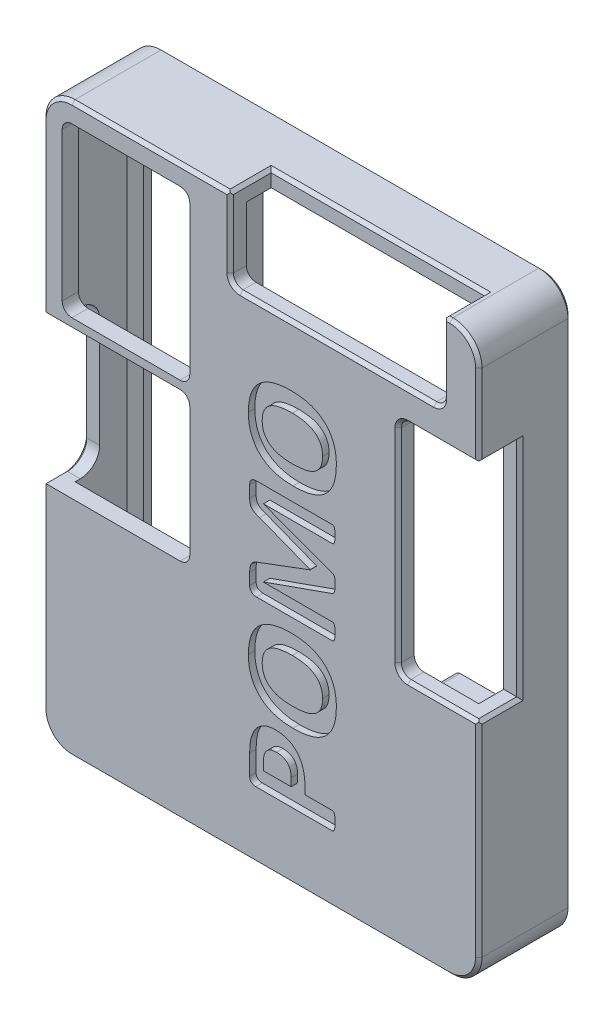
from build123d import *

# Parameters (mm, degrees)
SKETCH_1_W          = 27
SKETCH_1_H          = 35.2
SKETCH_1_W_2        = 25
SKETCH_1_H_2        = 33.2
EXTRUDE_1_DEPTH     = 2
SKETCH_1_3_W        = 27
SKETCH_1_3_H        = 35.2
SKETCH_1_3_W_2      = 25
SKETCH_1_3_H_2      = 33.2
EXTRUDE_2_DEPTH     = 3.72
FILLET_1_R          = 1.8
FILLET_2_R          = 0.8
CUT_EXTRUDE_1_REACH = 34.444
SKETCH_2_W          = 5.04
SKETCH_2_H          = 9.2
FILLET_3_R          = 1.2
CHAMFER_1_SIZE      = 0.2
EXTRUDE_START       = -1
EXTRUDE_3_DEPTH     = 1
SKETCH_4_W          = 1
SKETCH_4_H          = 9.2
CUT_EXTRUDE_2_DEPTH = 8.1
FILLET_4_R          = 0.6
CUT_EXTRUDE_3_DEPTH = 2.54
FILLET_5_R          = 0.6
SKETCH_6_W          = 2
SKETCH_6_H          = 3
EXTRUDE_4_DEPTH     = 1.54
FILLET_6_R          = 0.3
SKETCH_7_W          = 13.2
SKETCH_7_H          = 5
CUT_EXTRUDE_4_DEPTH = 2.54
FILLET_7_R          = 0.6
CHAMFER_2_SIZE      = 0.2
SKETCH_8_W          = 5
SKETCH_8_H          = 13.8
CUT_EXTRUDE_5_DEPTH = 2.54
FILLET_8_R          = 0.6
SKETCH_9_W          = 3
SKETCH_9_H          = 1.5
EXTRUDE_5_DEPTH     = 1.54
FILLET_9_R          = 0.3
SKETCH_10_W         = 1.5
SKETCH_10_H         = 8
EXTRUDE_6_DEPTH     = 1.54
FILLET_10_R         = 0.3
SKETCH_11_W         = 2.5
SKETCH_11_H         = 2.5
EXTRUDE_7_DEPTH     = 1.54
FILLET_11_R         = 0.3
CHAMFER_3_SIZE      = 0.2
CHAMFER_4_SIZE      = 0.2
CHAMFER_5_SIZE      = 0.2
CUT_EXTRUDE_6_DEPTH = 0.4
CHAMFER_6_SIZE      = 0.2


with BuildPart() as part:
    # 草图1 → 凸台-拉伸1 (new body)
    with BuildSketch(Plane.XY):
        Rectangle(SKETCH_1_W, SKETCH_1_H)
        Rectangle(SKETCH_1_W_2, SKETCH_1_H_2, mode=Mode.SUBTRACT)
    extrude(amount=-EXTRUDE_1_DEPTH)

    # 草图1<3> → 凸台-拉伸2 (add)
    with BuildSketch(Plane.XY):
        Rectangle(SKETCH_1_3_W, SKETCH_1_3_H)
        Rectangle(SKETCH_1_3_W_2, SKETCH_1_3_H_2, mode=Mode.SUBTRACT)
    extrude(amount=EXTRUDE_2_DEPTH)

    # 圆角1
    fillet_1_edges = [part.edges().sort_by_distance(p)[0] for p in [
        (-13.5, 17.6, 0.86),
        (13.5, 17.6, 0.86),
        (13.5, -17.6, 0.86),
        (-13.5, -17.6, 0.86),
    ]]
    fillet(fillet_1_edges, radius=FILLET_1_R)

    # 圆角2
    fillet_2_edges = [part.edges().sort_by_distance(p)[0] for p in [
        (-12.5, 16.6, 0.86),
        (12.5, 16.6, 0.86),
        (12.5, -16.6, 0.86),
        (-12.5, -16.6, 0.86),
    ]]
    fillet(fillet_2_edges, radius=FILLET_2_R)

    # 草图2 → 切除-拉伸1 (cut, up to next)
    with BuildSketch(Plane.ZY.offset(13.5), mode=Mode.PRIVATE) as cut_extrude_1_sk1:
        with Locations((3.72, 0.9)):
            Rectangle(SKETCH_2_W, SKETCH_2_H)
    cut_extrude_1_tool1 = extrude(cut_extrude_1_sk1.sketch, amount=-CUT_EXTRUDE_1_REACH, mode=Mode.PRIVATE) & part.part
    add(cut_extrude_1_tool1.solids().sort_by_distance((-13.5, 0.9, 3.72))[0], mode=Mode.SUBTRACT)

    # 圆角3
    fillet_3_edges = [part.edges().sort_by_distance(p)[0] for p in [
        (-13, 5.5, 1.2),
        (-13, -3.7, 1.2),
    ]]
    fillet(fillet_3_edges, radius=FILLET_3_R)

    # 倒角1
    chamfer_1_edges = [part.edges().sort_by_distance(p)[0] for p in [
        (-13.5, 5.5, 3.06),
        (-13.5, -3.7, 3.06),
        (-13.5, 0.9, 1.2),
        (-13.5, -3.348528137, 1.551471863),
        (-13.5, 5.148528137, 1.551471863),
    ]]
    chamfer(chamfer_1_edges, length=CHAMFER_1_SIZE)

    # 草图3 → 凸台-拉伸3 (add)
    with BuildSketch(Plane.XY.offset(3.72).offset(EXTRUDE_START)):
        with BuildLine():
            Line((-12.5, 5.5), (-12.5, -3.7))
            Line((-12.5, -3.7), (-12.5, -15.8))
            ThreePointArc((-12.5, -15.8), (-12.265685425, -16.365685425), (-11.7, -16.6))
            Line((-11.7, -16.6), (11.7, -16.6))
            ThreePointArc((11.7, -16.6), (12.265685425, -16.365685425), (12.5, -15.8))
            Line((12.5, -15.8), (12.5, 15.8))
            ThreePointArc((12.5, 15.8), (12.265685425, 16.365685425), (11.7, 16.6))
            Line((11.7, 16.6), (-11.7, 16.6))
            ThreePointArc((-11.7, 16.6), (-12.265685425, 16.365685425), (-12.5, 15.8))
            Line((-12.5, 15.8), (-12.5, 5.5))
        make_face()
    extrude(amount=EXTRUDE_3_DEPTH)

    # 草图4 → 切除-拉伸2 (cut)
    with BuildSketch(Plane.ZY.offset(12.5)):
        with Locations((3.22, 0.9)):
            Rectangle(SKETCH_4_W, SKETCH_4_H)
    extrude(amount=-CUT_EXTRUDE_2_DEPTH, mode=Mode.SUBTRACT)

    # 圆角4
    fillet_4_edges = [part.edges().sort_by_distance(p)[0] for p in [
        (-4.4, 5.5, 3.22),
        (-4.4, -3.7, 3.22),
    ]]
    fillet(fillet_4_edges, radius=FILLET_4_R)

    # 草图5 → 切除-拉伸3 (cut)
    with BuildSketch(Plane.XY.offset(3.72)):
        with BuildLine():
            Line((-12.3, 6), (-4.4, 6))
            Line((-4.4, 6), (-4.4, 16.4))
            Line((-4.4, 16.4), (-5.6, 16.4))
            Line((-5.6, 16.4), (-11.7, 16.4))
            ThreePointArc((-11.7, 16.4), (-12.124264069, 16.224264069), (-12.3, 15.8))
            Line((-12.3, 15.8), (-12.3, 7.2))
            Line((-12.3, 7.2), (-12.3, 6))
        make_face()
    extrude(amount=-CUT_EXTRUDE_3_DEPTH, mode=Mode.SUBTRACT)

    # 圆角5
    fillet_5_edges = [part.edges().sort_by_distance(p)[0] for p in [
        (-4.4, 16.4, 3.22),
        (-4.4, 6, 3.22),
        (-12.3, 6, 3.22),
    ]]
    fillet(fillet_5_edges, radius=FILLET_5_R)

    # 草图6 → 凸台-拉伸4 (add)
    with BuildSketch(Plane(origin=(0, 0, 2.72), x_dir=(-1, 0, 0), z_dir=(0, 0, -1))):
        with Locations((4.3, -15.1)):
            Rectangle(SKETCH_6_W, SKETCH_6_H)
    extrude(amount=EXTRUDE_4_DEPTH)

    # 圆角6
    fillet_6_edges = [part.edges().sort_by_distance(p)[0] for p in [
        (-5.3, -16.6, 1.95),
        (-5.3, -13.6, 1.95),
        (-3.3, -13.6, 1.95),
        (-3.3, -16.6, 1.95),
    ]]
    fillet(fillet_6_edges, radius=FILLET_6_R)

    # 草图7 → 切除-拉伸4 (cut)
    with BuildSketch(Plane.XY.offset(3.72)):
        with Locations((4.7, 15.1)):
            Rectangle(SKETCH_7_W, SKETCH_7_H)
    extrude(amount=-CUT_EXTRUDE_4_DEPTH, mode=Mode.SUBTRACT)

    # 圆角7
    fillet_7_edges = [part.edges().sort_by_distance(p)[0] for p in [
        (11.3, 12.6, 3.22),
        (-1.9, 12.6, 3.22),
    ]]
    fillet(fillet_7_edges, radius=FILLET_7_R)

    # 倒角2
    chamfer_2_edges = [part.edges().sort_by_distance(p)[0] for p in [
        (11.3, 17.6, 2.45),
        (4.7, 17.6, 1.18),
        (-1.9, 17.6, 2.45),
    ]]
    chamfer(chamfer_2_edges, length=CHAMFER_2_SIZE)

    # 草图8 → 切除-拉伸5 (cut)
    with BuildSketch(Plane.XY.offset(3.72)):
        with Locations((11, 3.8)):
            Rectangle(SKETCH_8_W, SKETCH_8_H)
    extrude(amount=-CUT_EXTRUDE_5_DEPTH, mode=Mode.SUBTRACT)

    # 圆角8
    fillet_8_edges = [part.edges().sort_by_distance(p)[0] for p in [
        (8.5, -3.1, 3.22),
        (8.5, 10.7, 3.22),
    ]]
    fillet(fillet_8_edges, radius=FILLET_8_R)

    # 草图9 → 凸台-拉伸5 (add)
    with BuildSketch(Plane(origin=(0, 0, 2.72), x_dir=(-1, 0, 0), z_dir=(0, 0, -1))):
        with Locations((-11, -4.35)):
            Rectangle(SKETCH_9_W, SKETCH_9_H)
    extrude(amount=EXTRUDE_5_DEPTH)

    # 圆角9
    fillet_9_edges = [part.edges().sort_by_distance(p)[0] for p in [
        (12.5, -3.6, 1.95),
        (12.5, -5.1, 1.95),
        (9.5, -5.1, 1.95),
        (9.5, -3.6, 1.95),
    ]]
    fillet(fillet_9_edges, radius=FILLET_9_R)

    # 草图10 → 凸台-拉伸6 (add)
    with BuildSketch(Plane(origin=(0, 0, 2.72), x_dir=(-1, 0, 0), z_dir=(0, 0, -1))):
        with Locations((3.15, 12.6)):
            Rectangle(SKETCH_10_W, SKETCH_10_H)
    extrude(amount=EXTRUDE_6_DEPTH)

    # 圆角10
    fillet_10_edges = [part.edges().sort_by_distance(p)[0] for p in [
        (-2.4, 16.6, 1.95),
        (-2.4, 8.6, 1.95),
        (-3.9, 8.6, 1.95),
        (-3.9, 16.6, 1.95),
    ]]
    fillet(fillet_10_edges, radius=FILLET_10_R)

    # 草图11 → 凸台-拉伸7 (add)
    with BuildSketch(Plane(origin=(0, 0, 2.72), x_dir=(-1, 0, 0), z_dir=(0, 0, -1))):
        with Locations((2.75, -3.65)):
            Rectangle(SKETCH_11_W, SKETCH_11_H)
    extrude(amount=EXTRUDE_7_DEPTH)

    # 圆角11
    fillet_11_edges = [part.edges().sort_by_distance(p)[0] for p in [
        (-1.5, -2.4, 1.95),
        (-1.5, -4.9, 1.95),
        (-4, -4.9, 1.95),
        (-4, -2.4, 1.95),
    ]]
    fillet(fillet_11_edges, radius=FILLET_11_R)

    # 倒角3
    chamfer_3_edges = [part.edges().sort_by_distance(p)[0] for p in [
        (13.5, -3.1, 2.45),
        (13.5, 3.8, 1.18),
        (13.5, 10.7, 2.45),
    ]]
    chamfer(chamfer_3_edges, length=CHAMFER_3_SIZE)

    # 倒角4
    chamfer_4_edges = [part.edges().sort_by_distance(p)[0] for p in [
        (-1.9, 15.3, 3.72),
        (11.3, 15.3, 3.72),
        (-1.724264069, 12.775735931, 3.72),
        (11.124264069, 12.775735931, 3.72),
        (4.7, 12.6, 3.72),
        (11.2, 10.7, 3.72),
        (11.2, -3.1, 3.72),
        (8.675735931, 10.524264069, 3.72),
        (8.675735931, -2.924264069, 3.72),
        (8.5, 3.8, 3.72),
    ]]
    chamfer(chamfer_4_edges, length=CHAMFER_4_SIZE)

    # 倒角5
    chamfer_5_edges = [part.edges().sort_by_distance(p)[0] for p in [
        (-6.9, 17.6, 3.72),
        (-12.972792206, 17.072792206, 3.72),
        (-13.5, 10.75, 3.72),
        (-13.5, -9.85, 3.72),
        (-12.972792206, -17.072792206, 3.72),
        (0, -17.6, 3.72),
        (12.972792206, -17.072792206, 3.72),
        (13.5, -9.55, 3.72),
        (11.6, 17.6, 3.72),
        (12.972792206, 17.072792206, 3.72),
        (13.5, 13.35, 3.72),
    ]]
    chamfer(chamfer_5_edges, length=CHAMFER_5_SIZE)

    # 草图12 → 切除-拉伸6 (cut)
    # profile 1 of 4: a face of its own
    with BuildSketch(Plane.XY.offset(3.72)):
        with BuildLine():
            add(Edge.make_bspline(
                [(0.901183364, -9.797794118), (0.972613791, -9.799211183), (1.111951502, -9.801975421), (1.314597214, -9.829791984), (1.505248522, -9.872435397), (1.682328126, -9.935059128), (1.846507268, -10.013399884), (1.99853428, -10.106594555), (2.134980403, -10.2186544), (2.259084362, -10.344600654), (2.368837936, -10.486871016), (2.465469751, -10.644435066), (2.546343318, -10.818241139), (2.614830726, -11.00644666), (2.668470661, -11.210700715), (2.705151223, -11.43212498), (2.728876729, -11.670597787), (2.73116948, -11.835608879), (2.732352941, -11.920783548)],
                knots=[0, 0, 0, 0, 1.074539163, 2.09607912, 3.072771053, 4.010465737, 4.916386775, 5.806831823, 6.687188898, 7.56722886, 8.462903837, 9.385716073, 10.343574317, 11.343239745, 12.39679321, 13.517064009, 14.718369485, 16, 16, 16, 16], degree=3))
            Line((2.732352941, -11.920783548), (2.732352941, -12.365808824))
            Line((2.732352941, -12.365808824), (4.42733992, -12.365808824))
            add(Edge.make_bspline(
                [(4.42733992, -12.365808824), (4.440606458, -12.366812536), (4.467642206, -12.368857992), (4.504518981, -12.392225512), (4.536551454, -12.429600756), (4.558138956, -12.486457401), (4.575653381, -12.560407983), (4.589954729, -12.655590339), (4.599755754, -12.775370304), (4.599912902, -12.863902664), (4.6, -12.912971048)],
                knots=[0, 0, 0, 0, 0.507711762, 1.034660904, 1.634861559, 2.386155658, 3.355649824, 4.577255722, 6.102970134, 8, 8, 8, 8], degree=3))
            add(Edge.make_bspline(
                [(4.6, -12.912971048), (4.599869662, -12.960819527), (4.599630734, -13.048533035), (4.589944903, -13.167933863), (4.575669786, -13.263859393), (4.558513881, -13.338101152), (4.536077842, -13.393927231), (4.505400135, -13.431352123), (4.467884047, -13.45193083), (4.441749907, -13.454149494), (4.428555836, -13.455269608)],
                knots=[0, 0, 0, 0, 1.863820652, 3.416665485, 4.662998336, 5.639730434, 6.382161058, 6.986842619, 7.488497825, 8, 8, 8, 8], degree=3))
            Line((4.428555836, -13.455269608), (-0.30865311, -13.455269608))
            add(Edge.make_bspline(
                [(-0.30865311, -13.455269608), (-0.33878567, -13.454405815), (-0.395719766, -13.452773719), (-0.475219877, -13.432574084), (-0.543582193, -13.401685625), (-0.598746602, -13.356387224), (-0.640226496, -13.300832057), (-0.669790503, -13.237002902), (-0.688669696, -13.165327508), (-0.690639938, -13.114532932), (-0.691666667, -13.08806296)],
                knots=[0, 0, 0, 0, 1.197016791, 2.261708478, 3.243544502, 4.161063564, 5.071314752, 5.980993455, 6.947859145, 8, 8, 8, 8], degree=3))
            Line((-0.691666667, -13.08806296), (-0.691666667, -11.828373928))
            add(Edge.make_bspline(
                [(-0.691666667, -11.828373928), (-0.6907798, -11.766766495), (-0.689045787, -11.646310894), (-0.682158919, -11.495707935), (-0.668551676, -11.374282396), (-0.655335546, -11.276142007), (-0.637598328, -11.1696505), (-0.618584906, -11.055049285), (-0.589238336, -10.936068308), (-0.55193587, -10.814551783), (-0.502161505, -10.693415718), (-0.44652035, -10.571471491), (-0.380338726, -10.453642017), (-0.302974791, -10.345050714), (-0.220811748, -10.242403543), (-0.127733921, -10.151708092), (-0.027590505, -10.069407072), (0.080976572, -9.997314393), (0.198101193, -9.936531626), (0.323304562, -9.886739659), (0.456046227, -9.845932092), (0.597546392, -9.81889316), (0.746724136, -9.801269834), (0.848846104, -9.798971836), (0.901183364, -9.797794118)],
                knots=[0, 0, 0, 0, 1.386044595, 2.710011219, 3.388595705, 4.13384621, 4.937223913, 5.817091178, 6.745811508, 7.691603293, 8.673527662, 9.689156292, 10.705766521, 11.707344315, 12.685579538, 13.659044931, 14.624450845, 15.597958928, 16.584780707, 17.587022182, 18.625313044, 19.703465755, 20.82303179, 22, 22, 22, 22], degree=3))
        make_face()
        with BuildLine():
            add(Edge.make_bspline(
                [(0.979001991, -10.965073529), (0.936777326, -10.966140914), (0.855549264, -10.968194253), (0.739557935, -10.986514524), (0.634913296, -11.016290284), (0.543014646, -11.059597433), (0.463061664, -11.111045532), (0.392481067, -11.166517204), (0.334582461, -11.229861951), (0.272368161, -11.319526809), (0.216659845, -11.441553261), (0.181448357, -11.596102223), (0.167215574, -11.754304108), (0.165305604, -11.860777116), (0.164338235, -11.914703968)],
                knots=[0, 0, 0, 0, 1.056080103, 2.031593088, 2.93025641, 3.769730843, 4.563214341, 5.306142896, 6.009595314, 6.701769354, 8.031456872, 9.335322757, 10.6503842, 12, 12, 12, 12], degree=3))
            Line((0.164338235, -11.914703968), (0.164338235, -12.365808824))
            Line((0.164338235, -12.365808824), (1.876348039, -12.365808824))
            Line((1.876348039, -12.365808824), (1.876348039, -11.890385646))
            add(Edge.make_bspline(
                [(1.876348039, -11.890385646), (1.875968306, -11.849803448), (1.875240657, -11.77203935), (1.860909636, -11.660728843), (1.841123431, -11.559125362), (1.811935037, -11.467377075), (1.774667723, -11.385139637), (1.732709692, -11.310130951), (1.682008802, -11.244199202), (1.607380601, -11.165739072), (1.494883483, -11.085066716), (1.339058118, -11.016701924), (1.164529299, -10.972930489), (1.042090811, -10.9677453), (0.979001991, -10.965073529)],
                knots=[0, 0, 0, 0, 0.995035643, 1.906699277, 2.749344999, 3.532547668, 4.262672946, 4.96214497, 5.63648749, 6.29772035, 7.614676787, 8.999192117, 10.453775203, 12, 12, 12, 12], degree=3))
        make_face(mode=Mode.SUBTRACT)
    # profile 2 of 4: a face of its own
    with BuildSketch(Plane.XY.offset(3.72)):
        with BuildLine():
            add(Edge.make_bspline(
                [(1.893370864, -4.117034314), (1.999654359, -4.118560019), (2.207046323, -4.121537142), (2.508873867, -4.154579405), (2.793941042, -4.204135629), (3.060625051, -4.277632617), (3.310245256, -4.369545137), (3.540637443, -4.482582813), (3.751816608, -4.615807107), (3.942403272, -4.76962472), (4.112569194, -4.943464761), (4.261889006, -5.13666699), (4.388927285, -5.34987787), (4.493348394, -5.582206132), (4.576445481, -5.833092318), (4.635614459, -6.103178409), (4.670976803, -6.392289308), (4.675496803, -6.59132184), (4.677818627, -6.693560432)],
                knots=[0, 0, 0, 0, 1.181156535, 2.304801635, 3.371651323, 4.394860601, 5.375831947, 6.325011814, 7.242593292, 8.146204565, 9.041610307, 9.941122527, 10.854567612, 11.794352514, 12.76760377, 13.787642918, 14.863561291, 16, 16, 16, 16], degree=3))
            add(Edge.make_bspline(
                [(4.677818627, -6.693560432), (4.676200771, -6.794164316), (4.673061466, -6.98937714), (4.641758464, -7.272280387), (4.593240461, -7.535845114), (4.522619889, -7.779550451), (4.431554699, -8.00371163), (4.318756282, -8.20843718), (4.186240697, -8.394996592), (4.029911707, -8.560489399), (3.852128128, -8.706278115), (3.651875886, -8.831700332), (3.43028259, -8.939344475), (3.185488916, -9.026341289), (2.918494823, -9.094351889), (2.628261615, -9.140356928), (2.315515326, -9.170261596), (2.098934824, -9.173547036), (1.9869964, -9.175245098)],
                knots=[0, 0, 0, 0, 1.14605125, 2.223809784, 3.239278066, 4.196657126, 5.110123641, 5.990760065, 6.854667985, 7.710749604, 8.577135683, 9.46770869, 10.397275983, 11.379066547, 12.423123567, 13.532494508, 14.724683554, 16, 16, 16, 16], degree=3))
            add(Edge.make_bspline(
                [(1.9869964, -9.175245098), (1.883173295, -9.172994873), (1.680340341, -9.168598744), (1.384159298, -9.138703639), (1.104262144, -9.085710504), (0.840174866, -9.015104438), (0.593423686, -8.922957216), (0.365967927, -8.809046986), (0.15645787, -8.676508104), (-0.032933786, -8.522650254), (-0.201824539, -8.348442092), (-0.350852833, -8.155861596), (-0.478306777, -7.943131122), (-0.583990262, -7.711026251), (-0.668376965, -7.459377825), (-0.727071368, -7.188240371), (-0.762789455, -6.897978988), (-0.767207257, -6.698125529), (-0.769485294, -6.595071232)],
                knots=[0, 0, 0, 0, 1.16084357, 2.267870255, 3.323776688, 4.342865402, 5.320924859, 6.263320928, 7.182293669, 8.087520472, 8.984851861, 9.889477264, 10.804227807, 11.751232516, 12.735748365, 13.766010587, 14.848044905, 16, 16, 16, 16], degree=3))
            add(Edge.make_bspline(
                [(-0.769485294, -6.595071232), (-0.76789129, -6.496487466), (-0.764793529, -6.30490135), (-0.733030949, -6.027002269), (-0.685900875, -5.766659049), (-0.616490073, -5.524605941), (-0.526680642, -5.300307738), (-0.414838562, -5.095074424), (-0.28078951, -4.909588578), (-0.126261279, -4.742810334), (0.049759607, -4.594030569), (0.249924795, -4.468650837), (0.469327865, -4.358877902), (0.711459072, -4.270930254), (0.975267052, -4.201849097), (1.261231859, -4.152810223), (1.569657019, -4.121775428), (1.783049216, -4.118650085), (1.893370864, -4.117034314)],
                knots=[0, 0, 0, 0, 1.13232307, 2.200538578, 3.20987167, 4.169455781, 5.088774695, 5.980828139, 6.848151256, 7.711589453, 8.587559702, 9.48804691, 10.419052874, 11.401863473, 12.442264771, 13.548661327, 14.732682238, 16, 16, 16, 16], degree=3))
        make_face()
        with BuildLine():
            add(Edge.make_bspline(
                [(1.951734835, -5.284313725), (1.883217835, -5.284872615), (1.749716335, -5.285961579), (1.553751429, -5.298566277), (1.367406743, -5.318616393), (1.190849515, -5.347918997), (1.02446509, -5.384467851), (0.870190455, -5.434192766), (0.72805753, -5.495202794), (0.598229443, -5.566738192), (0.481387793, -5.650762489), (0.379386258, -5.749325959), (0.2916771, -5.860909935), (0.216187259, -5.984733963), (0.1573585, -6.123893487), (0.116837249, -6.279091102), (0.090811169, -6.449909639), (0.087987158, -6.569435076), (0.086519608, -6.631548713)],
                knots=[0, 0, 0, 0, 1.248265319, 2.432174384, 3.576376217, 4.661773456, 5.691897974, 6.677459506, 7.610313763, 8.506217667, 9.373321131, 10.224651126, 11.0816001, 11.95297009, 12.859645075, 13.823439941, 14.868909707, 16, 16, 16, 16], degree=3))
            add(Edge.make_bspline(
                [(0.086519608, -6.631548713), (0.08827653, -6.694496062), (0.091650655, -6.815384887), (0.120399704, -6.988807842), (0.165170016, -7.147044791), (0.232324381, -7.288341356), (0.314404932, -7.414604545), (0.410272669, -7.526654021), (0.51674744, -7.627951735), (0.63687832, -7.71538415), (0.768126232, -7.79095877), (0.911122258, -7.852334576), (1.062979279, -7.905839093), (1.226054338, -7.942916422), (1.396190965, -7.972187485), (1.572030635, -7.991949173), (1.752482942, -8.006632097), (1.874290189, -8.007517599), (1.935927926, -8.007965686)],
                knots=[0, 0, 0, 0, 1.152919732, 2.214153814, 3.213115755, 4.15686128, 5.069606142, 5.965571736, 6.853650292, 7.756976077, 8.682031136, 9.623317766, 10.605259802, 11.628641841, 12.683774877, 13.768256425, 14.870677851, 16, 16, 16, 16], degree=3))
            add(Edge.make_bspline(
                [(1.935927926, -8.007965686), (2.006871474, -8.007372308), (2.145222136, -8.006215129), (2.346927279, -7.994157809), (2.537481044, -7.972915107), (2.717426679, -7.946603191), (2.885129675, -7.907318042), (3.041169989, -7.859560195), (3.183552149, -7.798002095), (3.314867615, -7.728055581), (3.433275239, -7.645193793), (3.535695554, -7.547309634), (3.62328772, -7.436363771), (3.695472489, -7.311899932), (3.753962128, -7.172542251), (3.792337689, -7.016238632), (3.817382063, -6.843922326), (3.820291585, -6.723651432), (3.821813725, -6.660730699)],
                knots=[0, 0, 0, 0, 1.27978995, 2.495784208, 3.643210933, 4.738378363, 5.774209323, 6.747805727, 7.678156778, 8.568091912, 9.428302703, 10.276495989, 11.114702537, 11.96998907, 12.864866912, 13.831408576, 14.865483101, 16, 16, 16, 16], degree=3))
            add(Edge.make_bspline(
                [(3.821813725, -6.660730699), (3.819839897, -6.597828284), (3.816051212, -6.477089618), (3.790240772, -6.303403028), (3.742203814, -6.146664884), (3.677485568, -6.005144614), (3.595964894, -5.878541143), (3.50082029, -5.76535022), (3.392552926, -5.66399099), (3.270389721, -5.577158578), (3.137180619, -5.501334543), (2.992843764, -5.438127466), (2.837718035, -5.386928447), (2.67258816, -5.349210733), (2.500351106, -5.320252202), (2.322131918, -5.300160687), (2.138818883, -5.285677082), (2.014586592, -5.284771752), (1.951734835, -5.284313725)],
                knots=[0, 0, 0, 0, 1.143945086, 2.195756789, 3.181997564, 4.115287819, 5.016929857, 5.911555589, 6.798099071, 7.706314528, 8.630568059, 9.580988568, 10.566898797, 11.596658038, 12.658109568, 13.741469892, 14.857361588, 16, 16, 16, 16], degree=3))
        make_face(mode=Mode.SUBTRACT)
    # profile 3 of 4: a face of its own
    with BuildSketch(Plane.XY.offset(3.72)):
        with BuildLine():
            add(Edge.make_bspline(
                [(4.428555836, 2.964460784), (4.441730785, 2.963270189), (4.467640009, 2.960928821), (4.50449307, 2.942070855), (4.536616065, 2.908310214), (4.558044764, 2.855239479), (4.575670638, 2.786128287), (4.589962702, 2.697000362), (4.599736752, 2.584904392), (4.59990626, 2.502035249), (4.6, 2.456207874)],
                knots=[0, 0, 0, 0, 0.539481876, 1.060919246, 1.661716257, 2.414407709, 3.380065772, 4.595891202, 6.117497459, 8, 8, 8, 8], degree=3))
            add(Edge.make_bspline(
                [(4.6, 2.456207874), (4.599893199, 2.411598531), (4.599698686, 2.330352783), (4.589878291, 2.219859959), (4.575729019, 2.131596471), (4.558359975, 2.062997804), (4.535754102, 2.011541553), (4.50578716, 1.976345592), (4.469108803, 1.956146735), (4.442968788, 1.953935161), (4.429771752, 1.952818627)],
                knots=[0, 0, 0, 0, 1.853187657, 3.375158875, 4.604682985, 5.564960195, 6.310882748, 6.919382208, 7.454439793, 8, 8, 8, 8], degree=3))
            Line((4.429771752, 1.952818627), (0.164338235, 1.952818627))
            Line((0.164338235, 1.952818627), (0.164338235, 1.944307215))
            Line((0.164338235, 1.944307215), (4.424908088, 0.373343673))
            add(Edge.make_bspline(
                [(4.424908088, 0.373343673), (4.441569565, 0.366910595), (4.473892615, 0.354430505), (4.515179032, 0.320769773), (4.545881599, 0.27429405), (4.570242275, 0.215825809), (4.586843293, 0.141893471), (4.595140691, 0.051313522), (4.599743194, -0.058253273), (4.599909338, -0.137739873), (4.6, -0.181114047)],
                knots=[0, 0, 0, 0, 0.686484186, 1.331770514, 2.017719291, 2.817120945, 3.76613975, 4.931024301, 6.325324192, 8, 8, 8, 8], degree=3))
            add(Edge.make_bspline(
                [(4.6, -0.181114047), (4.599771927, -0.224100497), (4.599351801, -0.303284365), (4.590569055, -0.412462912), (4.578361861, -0.503465299), (4.559047424, -0.577324344), (4.535136223, -0.636692508), (4.504562011, -0.681557882), (4.468109561, -0.714837979), (4.439164516, -0.725470984), (4.424908088, -0.730708104)],
                knots=[0, 0, 0, 0, 1.687656687, 3.108774587, 4.299683655, 5.28816724, 6.101256058, 6.798949485, 7.408441379, 8, 8, 8, 8], degree=3))
            Line((4.424908088, -0.730708104), (0.164338235, -2.240875843))
            Line((0.164338235, -2.240875843), (0.164338235, -2.249387255))
            Line((0.164338235, -2.249387255), (4.429771752, -2.249387255))
            add(Edge.make_bspline(
                [(4.429771752, -2.249387255), (4.442930327, -2.250594267), (4.468807349, -2.252967918), (4.505652507, -2.271450203), (4.536781844, -2.306307402), (4.558028616, -2.359825201), (4.575512132, -2.429801679), (4.589829415, -2.518470761), (4.599844009, -2.629746556), (4.599944103, -2.71181104), (4.6, -2.757640165)],
                knots=[0, 0, 0, 0, 0.540384415, 1.062694136, 1.65305456, 2.422175328, 3.405574817, 4.623434292, 6.114348081, 8, 8, 8, 8], degree=3))
            add(Edge.make_bspline(
                [(4.6, -2.757640165), (4.599886082, -2.802249297), (4.599678605, -2.883494663), (4.589937153, -2.99398982), (4.575443932, -3.083020619), (4.558290901, -3.152735214), (4.536527628, -3.205935568), (4.504828476, -3.24015459), (4.46730343, -3.257188698), (4.441676628, -3.259728861), (4.428555836, -3.261029412)],
                knots=[0, 0, 0, 0, 1.845850973, 3.361796777, 4.586453258, 5.575341207, 6.333499773, 6.938660624, 7.456599641, 8, 8, 8, 8], degree=3))
            Line((4.428555836, -3.261029412), (-0.263664216, -3.261029412))
            add(Edge.make_bspline(
                [(-0.263664216, -3.261029412), (-0.296196904, -3.259653734), (-0.358335306, -3.257026148), (-0.445627035, -3.236709173), (-0.520900128, -3.201846765), (-0.584171645, -3.154494544), (-0.632183131, -3.093102164), (-0.66643709, -3.022591068), (-0.687765906, -2.942861847), (-0.690329203, -2.88666656), (-0.691666667, -2.857345282)],
                knots=[0, 0, 0, 0, 1.17063607, 2.235949712, 3.202109941, 4.138955231, 5.052790002, 5.979466171, 6.945736586, 8, 8, 8, 8], degree=3))
            Line((-0.691666667, -2.857345282), (-0.691666667, -2.154545803))
            add(Edge.make_bspline(
                [(-0.691666667, -2.154545803), (-0.690577651, -2.096499597), (-0.688549172, -1.988378553), (-0.666050472, -1.837673996), (-0.626535832, -1.707931921), (-0.564415171, -1.597481067), (-0.479105657, -1.5053059), (-0.370382885, -1.42991321), (-0.237280465, -1.367747755), (-0.138090571, -1.337731883), (-0.084924556, -1.321643306)],
                knots=[0, 0, 0, 0, 1.221520091, 2.275291339, 3.19836942, 4.062177805, 4.919893421, 5.8197565, 6.831384386, 8, 8, 8, 8], degree=3))
            Line((-0.084924556, -1.321643306), (3.053354779, -0.148284314))
            Line((3.053354779, -0.148284314), (3.053354779, -0.131261489))
            Line((3.053354779, -0.131261489), (-0.076413143, 1.090734145))
            add(Edge.make_bspline(
                [(-0.076413143, 1.090734145), (-0.129465949, 1.108390654), (-0.228305706, 1.141285522), (-0.361958819, 1.201993879), (-0.47166271, 1.270499814), (-0.560341043, 1.348914558), (-0.624641056, 1.443883236), (-0.665804417, 1.554336689), (-0.688329388, 1.680735994), (-0.690510149, 1.770335079), (-0.691666667, 1.817851945)],
                knots=[0, 0, 0, 0, 1.279784294, 2.384295562, 3.352331854, 4.232573506, 5.074301061, 5.949833406, 6.912740106, 8, 8, 8, 8], degree=3))
            Line((-0.691666667, 1.817851945), (-0.691666667, 2.540106081))
            add(Edge.make_bspline(
                [(-0.691666667, 2.540106081), (-0.690387953, 2.574270767), (-0.688000695, 2.638053515), (-0.667433694, 2.727099478), (-0.632190724, 2.801894668), (-0.581995671, 2.862091252), (-0.519127966, 2.908105627), (-0.444091797, 2.940992138), (-0.35760738, 2.961966012), (-0.2958113, 2.96360708), (-0.263664216, 2.964460784)],
                knots=[0, 0, 0, 0, 1.189242937, 2.220221943, 3.161302073, 4.043652543, 4.922038901, 5.851176447, 6.882155453, 8, 8, 8, 8], degree=3))
            Line((-0.263664216, 2.964460784), (4.428555836, 2.964460784))
        make_face()
    # profile 4 of 4: a face of its own
    with BuildSketch(Plane.XY.offset(3.72)):
        with BuildLine():
            add(Edge.make_bspline(
                [(1.893370864, 8.878676471), (1.999654359, 8.877150765), (2.207046323, 8.874173642), (2.508873867, 8.841131379), (2.793941042, 8.791575156), (3.060625051, 8.718078167), (3.310245256, 8.626165647), (3.540637443, 8.513127972), (3.751816608, 8.379903678), (3.942403272, 8.226086065), (4.112569194, 8.052246023), (4.261889006, 7.859043794), (4.388927285, 7.645832914), (4.493348394, 7.413504652), (4.576445481, 7.162618467), (4.635614459, 6.892532376), (4.670976803, 6.603421476), (4.675496803, 6.404388944), (4.677818627, 6.302150352)],
                knots=[0, 0, 0, 0, 1.181156535, 2.304801635, 3.371651323, 4.394860601, 5.375831947, 6.325011814, 7.242593292, 8.146204565, 9.041610307, 9.941122527, 10.854567612, 11.794352514, 12.76760377, 13.787642918, 14.863561291, 16, 16, 16, 16], degree=3))
            add(Edge.make_bspline(
                [(4.677818627, 6.302150352), (4.676200771, 6.201546469), (4.673061466, 6.006333644), (4.641758464, 5.723430397), (4.593240461, 5.45986567), (4.522619889, 5.216160333), (4.431554699, 4.991999154), (4.318756282, 4.787273604), (4.186240697, 4.600714192), (4.029911707, 4.435221385), (3.852128128, 4.28943267), (3.651875886, 4.164010453), (3.43028259, 4.056366309), (3.185488916, 3.969369495), (2.918494823, 3.901358896), (2.628261615, 3.855353856), (2.315515326, 3.825449189), (2.098934824, 3.822163748), (1.9869964, 3.820465686)],
                knots=[0, 0, 0, 0, 1.14605125, 2.223809784, 3.239278066, 4.196657126, 5.110123641, 5.990760065, 6.854667985, 7.710749604, 8.577135683, 9.46770869, 10.397275983, 11.379066547, 12.423123567, 13.532494508, 14.724683554, 16, 16, 16, 16], degree=3))
            add(Edge.make_bspline(
                [(1.9869964, 3.820465686), (1.883173295, 3.822715911), (1.680340341, 3.82711204), (1.384159298, 3.857007145), (1.104262144, 3.91000028), (0.840174866, 3.980606347), (0.593423686, 4.072753568), (0.365967927, 4.186663798), (0.15645787, 4.319202681), (-0.032933786, 4.47306053), (-0.201824539, 4.647268692), (-0.350852833, 4.839849189), (-0.478306777, 5.052579662), (-0.583990262, 5.284684534), (-0.668376965, 5.53633296), (-0.727071368, 5.807470413), (-0.762789455, 6.097731797), (-0.767207257, 6.297585255), (-0.769485294, 6.400639553)],
                knots=[0, 0, 0, 0, 1.16084357, 2.267870255, 3.323776688, 4.342865402, 5.320924859, 6.263320928, 7.182293669, 8.087520472, 8.984851861, 9.889477264, 10.804227807, 11.751232516, 12.735748365, 13.766010587, 14.848044905, 16, 16, 16, 16], degree=3))
            add(Edge.make_bspline(
                [(-0.769485294, 6.400639553), (-0.76789129, 6.499223318), (-0.764793529, 6.690809434), (-0.733030949, 6.968708516), (-0.685900875, 7.229051735), (-0.616490073, 7.471104843), (-0.526680642, 7.695403046), (-0.414838562, 7.900636361), (-0.28078951, 8.086122206), (-0.126261279, 8.252900451), (0.049759607, 8.401680215), (0.249924795, 8.527059947), (0.469327865, 8.636832882), (0.711459072, 8.724780531), (0.975267052, 8.793861688), (1.261231859, 8.842900561), (1.569657019, 8.873935356), (1.783049216, 8.877060699), (1.893370864, 8.878676471)],
                knots=[0, 0, 0, 0, 1.13232307, 2.200538578, 3.20987167, 4.169455781, 5.088774695, 5.980828139, 6.848151256, 7.711589453, 8.587559702, 9.48804691, 10.419052874, 11.401863473, 12.442264771, 13.548661327, 14.732682238, 16, 16, 16, 16], degree=3))
        make_face()
        with BuildLine():
            add(Edge.make_bspline(
                [(1.951734835, 7.711397059), (1.883217835, 7.710838169), (1.749716335, 7.709749205), (1.553751429, 7.697144508), (1.367406743, 7.677094391), (1.190849515, 7.647791788), (1.02446509, 7.611242934), (0.870190455, 7.561518019), (0.72805753, 7.500507991), (0.598229443, 7.428972592), (0.481387793, 7.344948295), (0.379386258, 7.246384825), (0.2916771, 7.13480085), (0.216187259, 7.010976821), (0.1573585, 6.871817298), (0.116837249, 6.716619682), (0.090811169, 6.545801146), (0.087987158, 6.426275708), (0.086519608, 6.364162071)],
                knots=[0, 0, 0, 0, 1.248265319, 2.432174384, 3.576376217, 4.661773456, 5.691897974, 6.677459506, 7.610313763, 8.506217667, 9.373321131, 10.224651126, 11.0816001, 11.95297009, 12.859645075, 13.823439941, 14.868909707, 16, 16, 16, 16], degree=3))
            add(Edge.make_bspline(
                [(0.086519608, 6.364162071), (0.08827653, 6.301214722), (0.091650655, 6.180325897), (0.120399704, 6.006902942), (0.165170016, 5.848665993), (0.232324381, 5.707369429), (0.314404932, 5.581106239), (0.410272669, 5.469056764), (0.51674744, 5.367759049), (0.63687832, 5.280326634), (0.768126232, 5.204752015), (0.911122258, 5.143376208), (1.062979279, 5.089871691), (1.226054338, 5.052794362), (1.396190965, 5.023523299), (1.572030635, 5.003761611), (1.752482942, 4.989078687), (1.874290189, 4.988193186), (1.935927926, 4.987745098)],
                knots=[0, 0, 0, 0, 1.152919732, 2.214153814, 3.213115755, 4.15686128, 5.069606142, 5.965571736, 6.853650292, 7.756976077, 8.682031136, 9.623317766, 10.605259802, 11.628641841, 12.683774877, 13.768256425, 14.870677851, 16, 16, 16, 16], degree=3))
            add(Edge.make_bspline(
                [(1.935927926, 4.987745098), (2.006871474, 4.988338477), (2.145222136, 4.989495655), (2.346927279, 5.001552976), (2.537481044, 5.022795677), (2.717426679, 5.049107593), (2.885129675, 5.088392743), (3.041169989, 5.13615059), (3.183552149, 5.19770869), (3.314867615, 5.267655203), (3.433275239, 5.350516991), (3.535695554, 5.44840115), (3.62328772, 5.559347013), (3.695472489, 5.683810852), (3.753962128, 5.823168533), (3.792337689, 5.979472152), (3.817382063, 6.151788458), (3.820291585, 6.272059353), (3.821813725, 6.334980086)],
                knots=[0, 0, 0, 0, 1.27978995, 2.495784208, 3.643210933, 4.738378363, 5.774209323, 6.747805727, 7.678156778, 8.568091912, 9.428302703, 10.276495989, 11.114702537, 11.96998907, 12.864866912, 13.831408576, 14.865483101, 16, 16, 16, 16], degree=3))
            add(Edge.make_bspline(
                [(3.821813725, 6.334980086), (3.819839897, 6.3978825), (3.816051212, 6.518621166), (3.790240772, 6.692307756), (3.742203814, 6.8490459), (3.677485568, 6.99056617), (3.595964894, 7.117169641), (3.50082029, 7.230360564), (3.392552926, 7.331719794), (3.270389721, 7.418552206), (3.137180619, 7.494376242), (2.992843764, 7.557583319), (2.837718035, 7.608782337), (2.67258816, 7.646500051), (2.500351106, 7.675458582), (2.322131918, 7.695550097), (2.138818883, 7.710033702), (2.014586592, 7.710939033), (1.951734835, 7.711397059)],
                knots=[0, 0, 0, 0, 1.143945086, 2.195756789, 3.181997564, 4.115287819, 5.016929857, 5.911555589, 6.798099071, 7.706314528, 8.630568059, 9.580988568, 10.566898797, 11.596658038, 12.658109568, 13.741469892, 14.857361588, 16, 16, 16, 16], degree=3))
        make_face(mode=Mode.SUBTRACT)
    extrude(amount=-CUT_EXTRUDE_6_DEPTH, mode=Mode.SUBTRACT)

    # 倒角6
    chamfer_6_edges = [part.edges().sort_by_distance(p)[0] for p in [
        (13.5, 0, -2),
        (0, 17.6, -2),
        (-13.5, 0, -2),
        (0, -17.6, -2),
        (-12.972792206, 17.072792206, -2),
        (-12.972792206, -17.072792206, -2),
        (12.972792206, -17.072792206, -2),
        (12.972792206, 17.072792206, -2),
    ]]
    chamfer(chamfer_6_edges, length=CHAMFER_6_SIZE)

    # 切除-扫描1: sweep along a path in 草图13
    with BuildLine(Plane(origin=(0, 0, -1), x_dir=(-1, 0, 0), z_dir=(0, 0, -1))) as sweep_1_path:
        Line((12.5, -15.8), (12.5, 15.8))
        ThreePointArc((12.5, 15.8), (12.265685425, 16.365685425), (11.7, 16.6))
        Line((11.7, 16.6), (-11.7, 16.6))
        ThreePointArc((-11.7, 16.6), (-12.265685425, 16.365685425), (-12.5, 15.8))
        Line((-12.5, 15.8), (-12.5, -15.8))
        ThreePointArc((-12.5, -15.8), (-12.265685425, -16.365685425), (-11.7, -16.6))
        Line((-11.7, -16.6), (11.7, -16.6))
        ThreePointArc((11.7, -16.6), (12.265685425, -16.365685425), (12.5, -15.8))
    # 草图14 → 切除-扫描1 (sweep, cut)
    with BuildSketch(Plane.ZY.offset(3.5)):
        Polygon((-1.5, 16.6), (-0.5, 16.6), (-1, 17.1), align=None)
    sweep(path=sweep_1_path.line, mode=Mode.SUBTRACT)


solid = part.part
